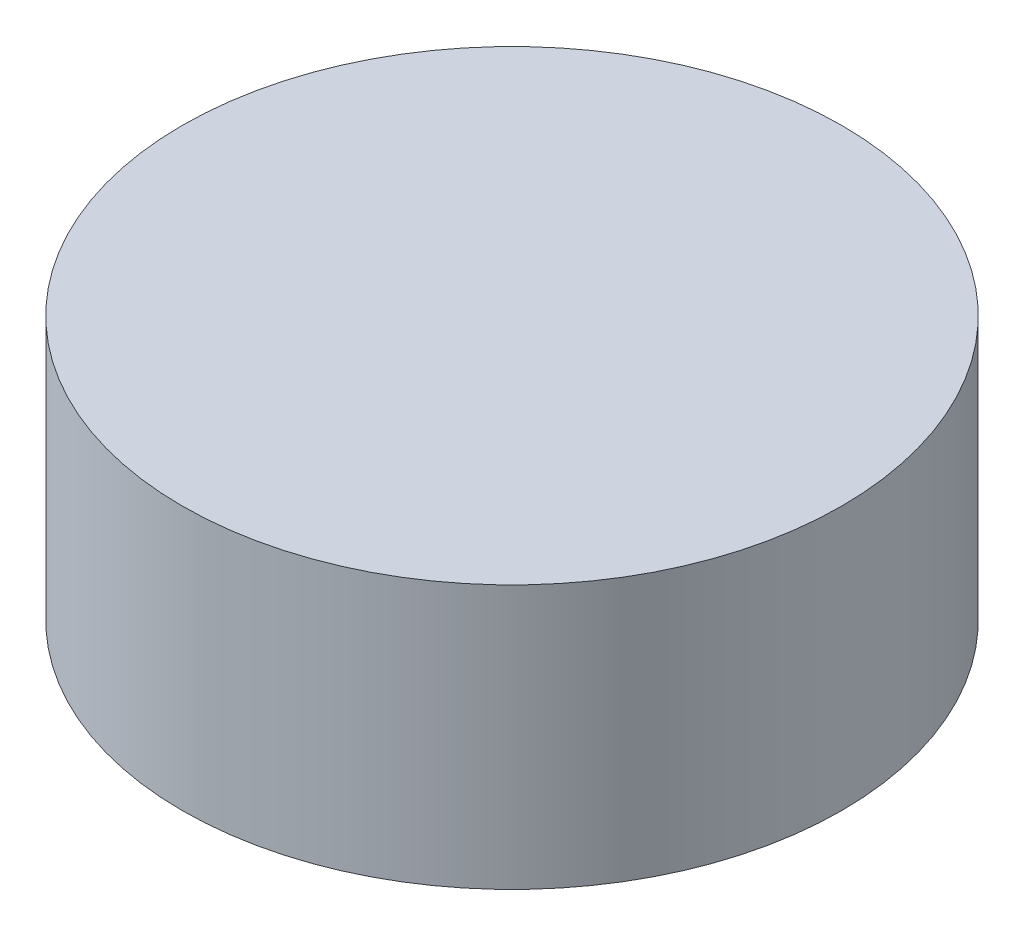
from build123d import *

# Parameters (mm, degrees)
SKETCH1_R           = 6.35
BOSS_EXTRUDE1_DEPTH = 5.08


with BuildPart() as part:
    # Sketch1 → Boss-Extrude1 (new body)
    with BuildSketch(Plane(origin=(0, 0, 0), x_dir=(1, 0, 0), z_dir=(0, 1, 0))):
        with Locations(Location((0, 0, 0), (0, 0, 270))):
            Circle(SKETCH1_R)
    extrude(amount=BOSS_EXTRUDE1_DEPTH)


solid = part.part
